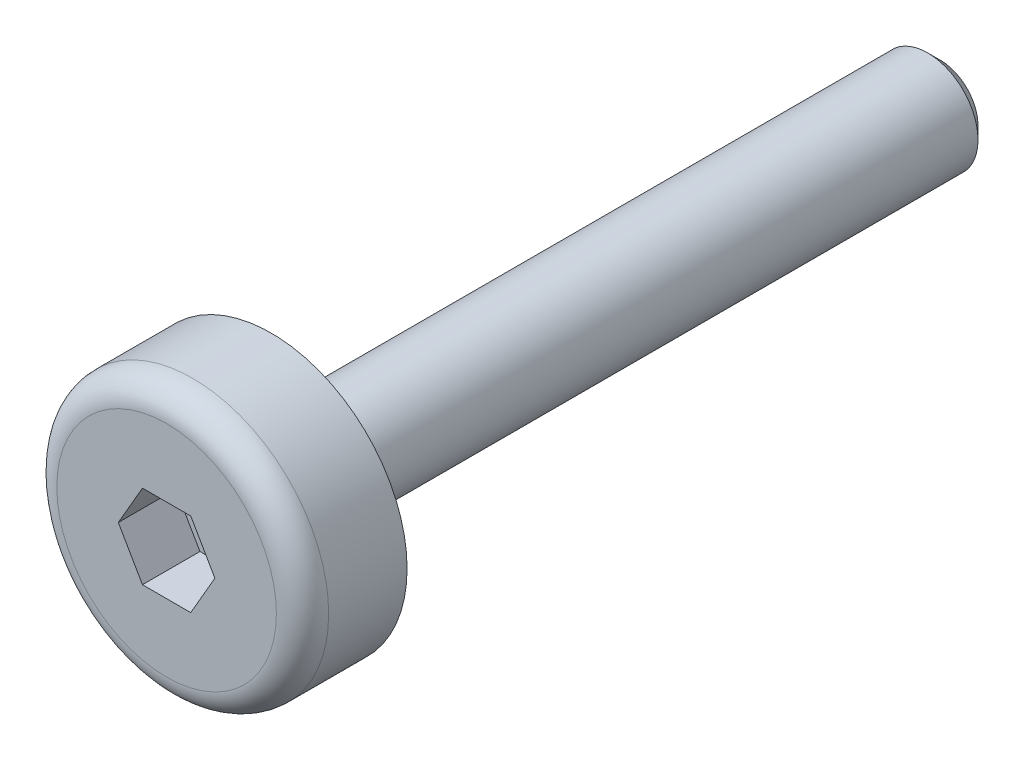
from build123d import *

# Parameters (mm, degrees)
SHANK_TIP_CHAMFER_SIZE = 0.3
PAN_HEAD_ROUND_R       = 0.625
HEX_DRIVE_CUT_DEPTH    = 1.375


with BuildPart() as part:
    # Screw Section → Screw Blank Revolve (revolve)
    with BuildSketch(Plane(origin=(0, 0, 0), x_dir=(1, 0, 0), z_dir=(0, 1, 0))):
        Polygon((0, 16), (1.2, 16), (1.2, 0), (3.25, 0), (3.25, -2.5), (0, -2.5), align=None)
    revolve(axis=Axis((0, 0, 10.123), (0, 0, -1)))

    # Shank Tip Chamfer
    shank_tip_chamfer_edges = [part.edges().sort_by_distance(p)[0] for p in [
        (-1.2, 0, -16),
    ]]
    chamfer(shank_tip_chamfer_edges, length=SHANK_TIP_CHAMFER_SIZE)

    # Pan Head Round
    pan_head_round_edges = [part.edges().sort_by_distance(p)[0] for p in [
        (-3.25, 0, 2.5),
    ]]
    fillet(pan_head_round_edges, radius=PAN_HEAD_ROUND_R)

    # Hex Drive Sketch → Hex Drive Cut (cut)
    with BuildSketch(Plane.XY.offset(2.5)):
        Polygon((1.154700538, 0), (0.577350269, 1), (-0.577350269, 1), (-1.154700538, 0), (-0.577350269, -1), (0.577350269, -1), align=None)
    extrude(amount=-HEX_DRIVE_CUT_DEPTH, mode=Mode.SUBTRACT)


solid = part.part
